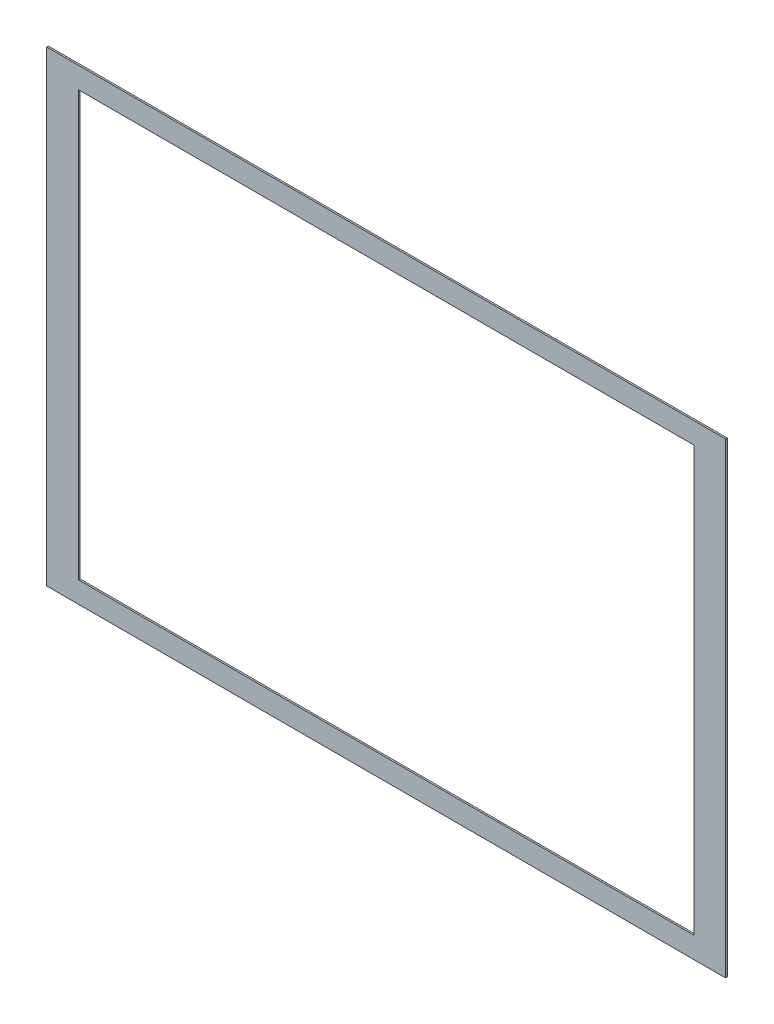
from build123d import *

# Parameters (mm, degrees)
PACK_PANEL_KUTULAMA_1_START = 38.5
SKETCH1_W                   = 640
SKETCH1_H                   = 440
PACK_PANEL_KUTULAMA_1_DEPTH = 1.5
PACK_PANEL_KUTULAMA_2_START = 37.5
SKETCH2_W                   = 580
SKETCH2_H                   = 400
PACK_PANEL_KUTULAMA_2_DEPTH = 3.5


with BuildPart() as part:
    # Sketch1 → PACK_panel_kutulama_1 (new body)
    with BuildSketch(Plane.XY.offset(PACK_PANEL_KUTULAMA_1_START)):
        with Locations((350, 820)):
            Rectangle(SKETCH1_W, SKETCH1_H)
    extrude(amount=PACK_PANEL_KUTULAMA_1_DEPTH)

    # Sketch2 → PACK_panel_kutulama_2 (cut)
    with BuildSketch(Plane.XY.offset(PACK_PANEL_KUTULAMA_2_START)):
        with Locations((350, 820)):
            Rectangle(SKETCH2_W, SKETCH2_H)
    extrude(amount=PACK_PANEL_KUTULAMA_2_DEPTH, mode=Mode.SUBTRACT)


solid = part.part
